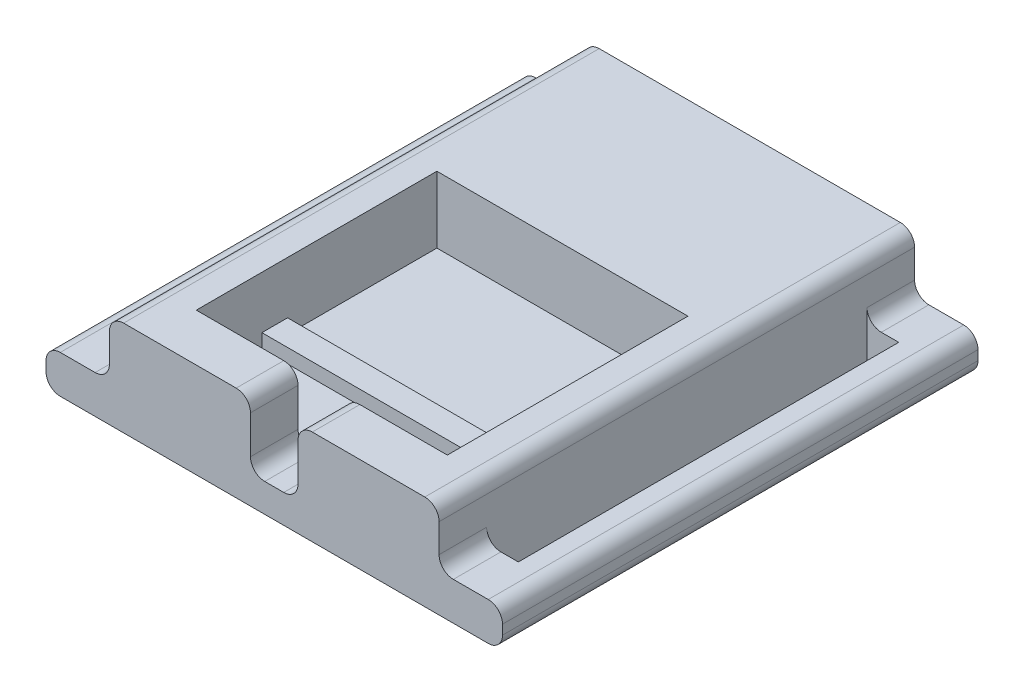
from build123d import *

# Parameters (mm, degrees)
SKETCH1_W            = 48
SKETCH1_H            = 50
SKETCH1_W_2          = 3.334
SKETCH1_H_2          = 40
BOSS_EXTRUDE1_DEPTH  = 4
SKETCH2_W            = 4.134
SKETCH2_H            = 50
BOSS_EXTRUDE2_DEPTH  = 6
SKETCH8_W            = 4.134
SKETCH8_H            = 50
BOSS_EXTRUDE6_DEPTH  = 6
SKETCH9_W            = 26.398
SKETCH9_H            = 19.7
BOSS_EXTRUDE7_DEPTH  = 6
SKETCH10_W           = 26.398
SKETCH10_H           = 5
BOSS_EXTRUDE8_DEPTH  = 6
SKETCH11_W           = 5
SKETCH11_H           = 5
CUT_EXTRUDE1_DEPTH   = 7
FILLET9_R            = 1.5
FILLET10_R           = 1.5
FILLET13_R           = 1.5
FILLET14_R           = 1.5
FILLET15_R           = 1.5
SKETCH12_W           = 26.398
SKETCH12_H           = 25.3
CUT_EXTRUDE2_DEPTH   = 1
SKETCH13_W           = 26.398
SKETCH13_H           = 2.7
BOSS_EXTRUDE10_DEPTH = 1.5
FILLET18_R           = 1.5
FILLET19_R           = 1.5


with BuildPart() as part:
    # Sketch1 → Boss-Extrude1 (new body)
    with BuildSketch(Plane(origin=(0, 0, 0), x_dir=(1, 0, 0), z_dir=(0, 1, 0))):
        with Locations((6.467329328, 13.494184872)):
            Rectangle(SKETCH1_W, SKETCH1_H)
        with Locations((25.467329328, 13.494184872)):
            Rectangle(SKETCH1_W_2, SKETCH1_H_2, mode=Mode.SUBTRACT)
        with Locations((-12.532670672, 13.494184872)):
            Rectangle(SKETCH1_W_2, SKETCH1_H_2, mode=Mode.SUBTRACT)
    extrude(amount=BOSS_EXTRUDE1_DEPTH)

    # Sketch2 → Boss-Extrude2 (add)
    with BuildSketch(Plane(origin=(0, 4, 0), x_dir=(1, 0, 0), z_dir=(0, 1, 0))):
        with Locations((-8.798670672, 13.494184872)):
            Rectangle(SKETCH2_W, SKETCH2_H)
    extrude(amount=BOSS_EXTRUDE2_DEPTH)

    # Sketch8 → Boss-Extrude6 (add)
    with BuildSketch(Plane(origin=(0, 4, 0), x_dir=(1, 0, 0), z_dir=(0, 1, 0))):
        with Locations((21.733329328, 13.494184872)):
            Rectangle(SKETCH8_W, SKETCH8_H)
    extrude(amount=BOSS_EXTRUDE6_DEPTH)

    # Sketch9 → Boss-Extrude7 (add)
    with BuildSketch(Plane(origin=(0, 4, 0), x_dir=(1, 0, 0), z_dir=(0, 1, 0))):
        with Locations((6.467329328, 28.644184872)):
            Rectangle(SKETCH9_W, SKETCH9_H)
    extrude(amount=BOSS_EXTRUDE7_DEPTH)

    # Sketch10 → Boss-Extrude8 (add)
    with BuildSketch(Plane(origin=(0, 4, 0), x_dir=(1, 0, 0), z_dir=(0, 1, 0))):
        with Locations((6.467329328, -9.005815128)):
            Rectangle(SKETCH10_W, SKETCH10_H)
    extrude(amount=BOSS_EXTRUDE8_DEPTH)

    # Sketch11 → Cut-Extrude1 (cut)
    with BuildSketch(Plane(origin=(0, 10, 0), x_dir=(1, 0, 0), z_dir=(0, 1, 0))):
        with Locations((6.468329328, -9.005815128)):
            Rectangle(SKETCH11_W, SKETCH11_H)
    extrude(amount=-CUT_EXTRUDE1_DEPTH, mode=Mode.SUBTRACT)

    # Fillet9
    fillet9_edges = [part.edges().sort_by_distance(p)[0] for p in [
        (-10.865670672, 4, 9.005815128),
    ]]
    fillet(fillet9_edges, radius=FILLET9_R)

    # Fillet10
    fillet10_edges = [part.edges().sort_by_distance(p)[0] for p in [
        (-10.865670672, 4, -35.994184872),
    ]]
    fillet(fillet10_edges, radius=FILLET10_R)

    # Fillet13
    fillet13_edges = [part.edges().sort_by_distance(p)[0] for p in [
        (23.800329328, 4, -35.994184872),
    ]]
    fillet(fillet13_edges, radius=FILLET13_R)

    # Fillet14
    fillet14_edges = [part.edges().sort_by_distance(p)[0] for p in [
        (23.800329328, 4, 9.005815128),
    ]]
    fillet(fillet14_edges, radius=FILLET14_R)

    # Fillet15
    fillet15_edges = [part.edges().sort_by_distance(p)[0] for p in [
        (3.968329328, 10, 9.005815128),
        (8.968329328, 10, 9.005815128),
        (30.467329328, 4, -13.494184872),
        (-10.865670672, 10, -13.494184872),
        (-17.532670672, 4, -13.494184872),
        (30.467329328, 0, -13.494184872),
        (-17.532670672, 0, -13.494184872),
        (23.800329328, 10, -13.494184872),
    ]]
    fillet(fillet15_edges, radius=FILLET15_R)

    # Sketch12 → Cut-Extrude2 (cut)
    with BuildSketch(Plane(origin=(0, 4, 0), x_dir=(1, 0, 0), z_dir=(0, 1, 0))):
        with Locations((6.467329328, 6.144184872)):
            Rectangle(SKETCH12_W, SKETCH12_H)
    extrude(amount=-CUT_EXTRUDE2_DEPTH, mode=Mode.SUBTRACT)

    # Sketch13 → Boss-Extrude10 (add)
    with BuildSketch(Plane(origin=(0, 3, 0), x_dir=(1, 0, 0), z_dir=(0, 1, 0))):
        with Locations((6.467329328, 1.744184872)):
            Rectangle(SKETCH13_W, SKETCH13_H)
    extrude(amount=BOSS_EXTRUDE10_DEPTH)

    # Fillet18
    fillet18_edges = [part.edges().sort_by_distance(p)[0] for p in [
        (3.968329328, 3, 9.005815128),
    ]]
    fillet(fillet18_edges, radius=FILLET18_R)

    # Fillet19
    fillet19_edges = [part.edges().sort_by_distance(p)[0] for p in [
        (8.968329328, 3, 9.005815128),
    ]]
    fillet(fillet19_edges, radius=FILLET19_R)


solid = part.part
